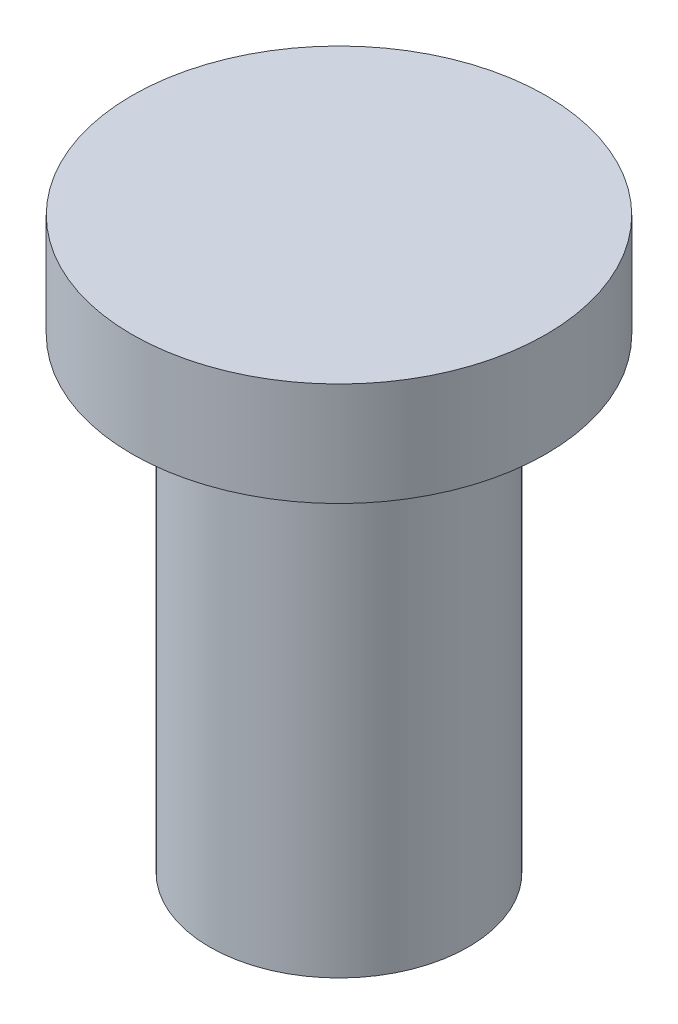
from build123d import *

# Parameters (mm, degrees)
SKETCH3_R           = 1.25
BOSS_EXTRUDE1_DEPTH = 4.5
SKETCH4_R           = 2
BOSS_EXTRUDE2_DEPTH = 1


with BuildPart() as part:
    # Sketch3 → Boss-Extrude1 (new body)
    with BuildSketch(Plane(origin=(0, 0, 0), x_dir=(1, 0, 0), z_dir=(0, 1, 0))):
        with Locations(Location((0, 0, 0), (0, 0, 270))):
            Circle(SKETCH3_R)
    extrude(amount=BOSS_EXTRUDE1_DEPTH)

    # Sketch4 → Boss-Extrude2 (add)
    with BuildSketch(Plane(origin=(0, 4.5, 0), x_dir=(1, 0, 0), z_dir=(0, 1, 0))):
        with Locations(Location((0, 0, 0), (0, 0, 270))):
            Circle(SKETCH4_R)
    extrude(amount=BOSS_EXTRUDE2_DEPTH)


solid = part.part
